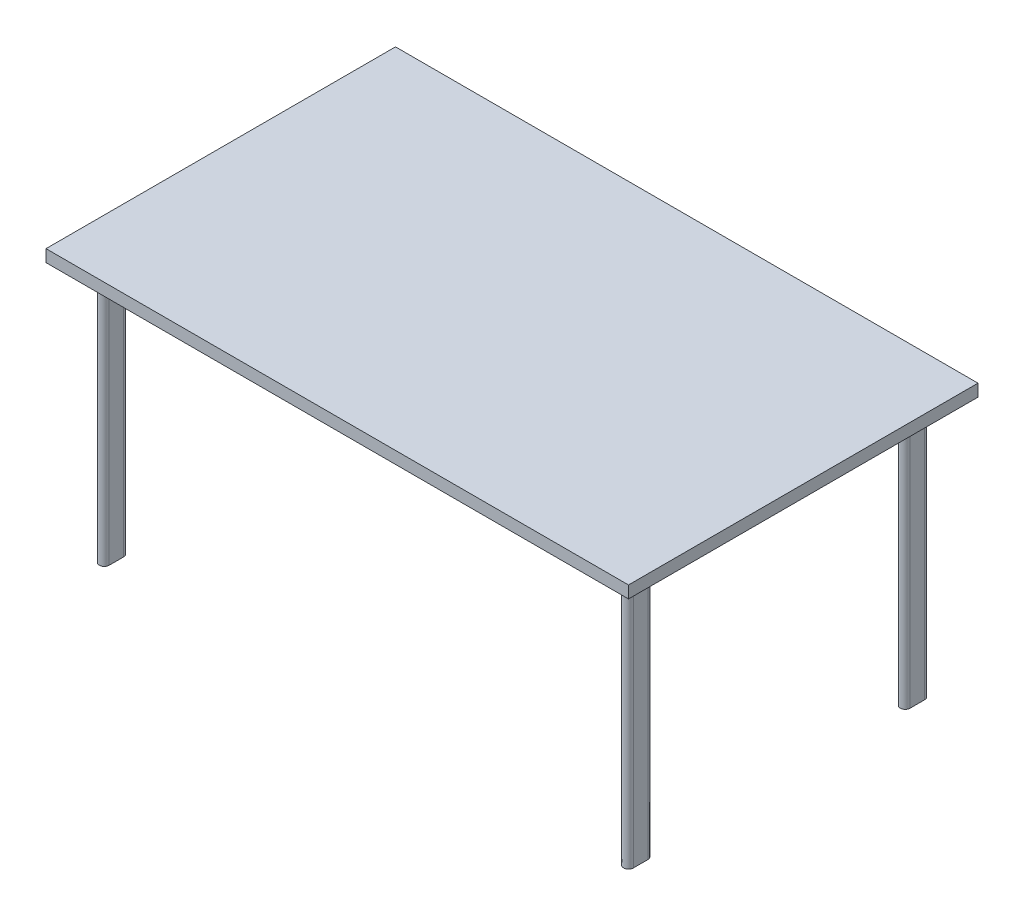
from build123d import *

# Parameters (mm, degrees)
SKETCH1_W           = 1524
SKETCH1_H           = 914.4
BOSS_EXTRUDE1_DEPTH = 31.75
BOSS_EXTRUDE2_DEPTH = 679.45


with BuildPart() as part:
    # Sketch1 → Boss-Extrude1 (new body)
    with BuildSketch(Plane(origin=(0, 0, 0), x_dir=(1, 0, 0), z_dir=(0, 1, 0))):
        Rectangle(SKETCH1_W, SKETCH1_H)
    extrude(amount=-BOSS_EXTRUDE1_DEPTH)

    # Sketch2 → Boss-Extrude2 (add)
    with BuildSketch(Plane.XZ.offset(31.75)):
        with BuildLine():
            Line((-698.5, -342.9), (-698.5, -381))
            ThreePointArc((-698.5, -381), (-685.8, -393.7), (-673.1, -381))
            Line((-673.1, -381), (-673.1, -342.9))
            ThreePointArc((-673.1, -342.9), (-685.8, -330.2), (-698.5, -342.9))
        make_face()
        with BuildLine():
            Line((-698.5, 381), (-698.5, 342.9))
            ThreePointArc((-698.5, 342.9), (-685.8, 330.2), (-673.1, 342.9))
            Line((-673.1, 342.9), (-673.1, 381))
            ThreePointArc((-673.1, 381), (-685.8, 393.7), (-698.5, 381))
        make_face()
        with BuildLine():
            Line((673.1, 381), (673.1, 342.9))
            ThreePointArc((673.1, 342.9), (685.8, 330.2), (698.5, 342.9))
            Line((698.5, 342.9), (698.5, 381))
            ThreePointArc((698.5, 381), (685.8, 393.7), (673.1, 381))
        make_face()
        with BuildLine():
            Line((673.1, -342.9), (673.1, -381))
            ThreePointArc((673.1, -381), (685.8, -393.7), (698.5, -381))
            Line((698.5, -381), (698.5, -342.9))
            ThreePointArc((698.5, -342.9), (685.8, -330.2), (673.1, -342.9))
        make_face()
    extrude(amount=BOSS_EXTRUDE2_DEPTH)


solid = part.part
